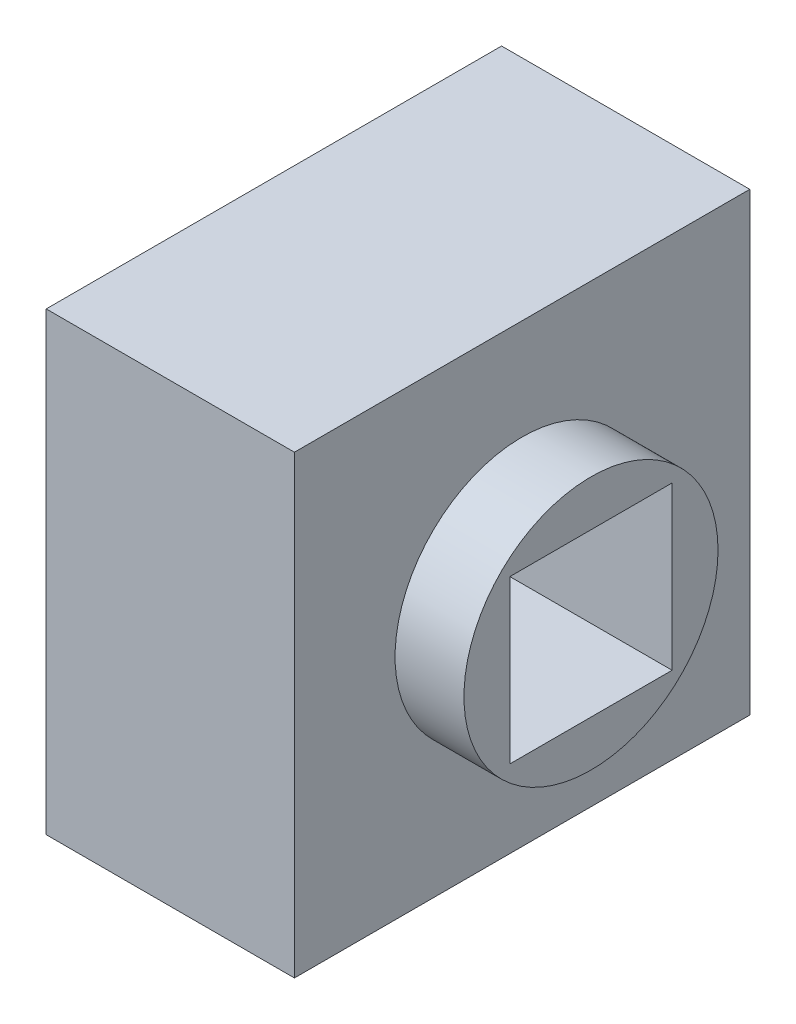
from build123d import *

# Parameters (mm, degrees)
SKETCH2_W           = 23.3
SKETCH2_H           = 23.3
SKETCH2_W_2         = 8.3
SKETCH2_H_2         = 8.3
EXTRUDE_THIN1_DEPTH = 12.7
SKETCH3_R           = 6.5
SKETCH3_W           = 8.3
SKETCH3_H           = 8.3
BOSS_EXTRUDE1_DEPTH = 3.525


with BuildPart() as part:
    # Sketch2 → Extrude-Thin1 (new body)
    with BuildSketch(Plane(origin=(0, 0, 0), x_dir=(0, 0, -1), z_dir=(1, 0, 0))):
        with Locations((4.15, 4.15)):
            Rectangle(SKETCH2_W, SKETCH2_H)
        with Locations((4.15, 4.15)):
            Rectangle(SKETCH2_W_2, SKETCH2_H_2, mode=Mode.SUBTRACT)
    extrude(amount=EXTRUDE_THIN1_DEPTH)

    # Sketch3 → Boss-Extrude1 (add)
    with BuildSketch(Plane(origin=(12.7, 0, 0), x_dir=(0, 0, -1), z_dir=(1, 0, 0))):
        with Locations((4.15, 4.15)):
            Circle(SKETCH3_R)
        with Locations((4.15, 4.15)):
            Rectangle(SKETCH3_W, SKETCH3_H, mode=Mode.SUBTRACT)
    extrude(amount=BOSS_EXTRUDE1_DEPTH)


solid = part.part
